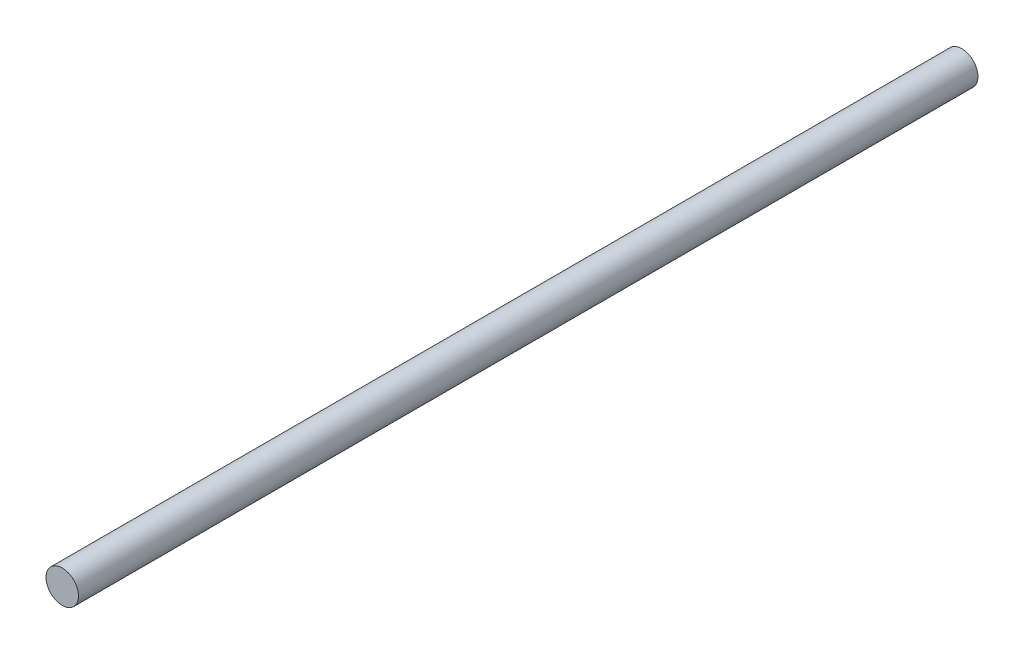
from build123d import *


with BuildPart() as part:
    # Sketch1 → Revolve1 (revolve)
    with BuildSketch(Plane(origin=(0, 0, 0), x_dir=(0, 0, -1), z_dir=(1, 0, 0))):
        Polygon((0, 0), (-0.403083478, 2.286), (-127, 2.286), (-127, 0), align=None)
    revolve(axis=Axis((0, 0, -3.942180287), (0, 0, 1)))


solid = part.part
